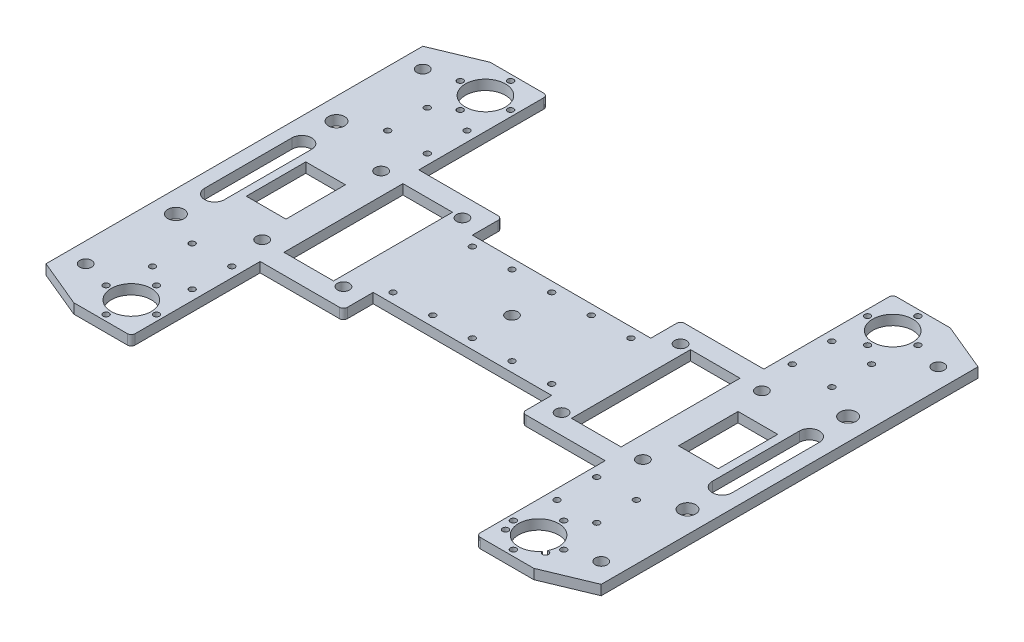
from build123d import *

# Parameters (mm, degrees)
ESQUISSE2_R                   = 3
ESQUISSE2_R_2                 = 10.1
ESQUISSE2_R_3                 = 1.5
ESQUISSE2_R_4                 = 4.1
ESQUISSE2_W                   = 25
ESQUISSE2_H                   = 60
ESQUISSE2_W_2                 = 20
ESQUISSE2_H_2                 = 30
BOSS_EXTRU_1_DEPTH            = 5
CONG_2_R                      = 2
DIAM_TRE_DU_PER_AGE_3_0_3_1_D = 3
ESQUISSE6_R                   = 1.495854397
ESQUISSE6_R_2                 = 1.51008819
ENL_V_MAT_EXTRU_1_DEPTH       = 10


with BuildPart() as part:
    # Esquisse2 → Boss.-Extru.1 (new body)
    with BuildSketch(Plane(origin=(0, 0, 0), x_dir=(1, 0, 0), z_dir=(0, 1, 0))):
        Polygon((-140, 95), (-140, -95), (-116, -105), (-87, -105), (-87, -40), (-45, -40), (-45, -25), (45, -25), (45, -40), (87, -40), (87, -105), (116, -105), (140, -95), (140, 95), (116, 105), (87, 105), (87, 40), (45, 40), (45, 25), (-45, 25), (-45, 40), (-87, 40), (-87, 105), (-116, 105), align=None)
        with Locations(Location((-96, 30, 0), (0, 0, 270))):
            Circle(ESQUISSE2_R, mode=Mode.SUBTRACT)
        with Locations(Location((-96, -30, 0), (0, 0, 270))):
            Circle(ESQUISSE2_R, mode=Mode.SUBTRACT)
        with Locations(Location((-55, -30, 0), (0, 0, 270))):
            Circle(ESQUISSE2_R, mode=Mode.SUBTRACT)
        with Locations(Location((-55, 30, 0), (0, 0, 270))):
            Circle(ESQUISSE2_R, mode=Mode.SUBTRACT)
        with Locations(Location((-130, 85, 0), (0, 0, 270))):
            Circle(ESQUISSE2_R, mode=Mode.SUBTRACT)
        with Locations(Location((-130, -85, 0), (0, 0, 270))):
            Circle(ESQUISSE2_R, mode=Mode.SUBTRACT)
        with Locations(Location((-102.7, 89.3, 0), (0, 0, 270))):
            Circle(ESQUISSE2_R_2, mode=Mode.SUBTRACT)
        with Locations(Location((-90, 89.3, 0), (0, 0, 270))):
            Circle(ESQUISSE2_R_3, mode=Mode.SUBTRACT)
        with Locations(Location((-102.7, 102, 0), (0, 0, 270))):
            Circle(ESQUISSE2_R_3, mode=Mode.SUBTRACT)
        with Locations(Location((-115.4, 89.3, 0), (0, 0, 270))):
            Circle(ESQUISSE2_R_3, mode=Mode.SUBTRACT)
        with Locations(Location((-102.7, 76.6, 0), (0, 0, 270))):
            Circle(ESQUISSE2_R_3, mode=Mode.SUBTRACT)
        with Locations(Location((-102.7, -89.3, 0), (0, 0, 270))):
            Circle(ESQUISSE2_R_2, mode=Mode.SUBTRACT)
        with Locations(Location((-90, -89.3, 0), (0, 0, 270))):
            Circle(ESQUISSE2_R_3, mode=Mode.SUBTRACT)
        with Locations(Location((-102.7, -76.6, 0), (0, 0, 270))):
            Circle(ESQUISSE2_R_3, mode=Mode.SUBTRACT)
        with Locations(Location((-115.4, -89.3, 0), (0, 0, 270))):
            Circle(ESQUISSE2_R_3, mode=Mode.SUBTRACT)
        with Locations(Location((-102.7, -102, 0), (0, 0, 270))):
            Circle(ESQUISSE2_R_3, mode=Mode.SUBTRACT)
        with Locations(Location((102.7, -102, 0), (0, 0, 90))):
            Circle(ESQUISSE2_R_3, mode=Mode.SUBTRACT)
        with Locations(Location((115.4, -89.3, 0), (0, 0, 90))):
            Circle(ESQUISSE2_R_3, mode=Mode.SUBTRACT)
        with Locations(Location((102.7, -76.6, 0), (0, 0, 90))):
            Circle(ESQUISSE2_R_3, mode=Mode.SUBTRACT)
        with Locations(Location((90, -89.3, 0), (0, 0, 90))):
            Circle(ESQUISSE2_R_3, mode=Mode.SUBTRACT)
        with Locations(Location((102.7, -89.3, 0), (0, 0, 90))):
            Circle(ESQUISSE2_R_2, mode=Mode.SUBTRACT)
        with Locations(Location((102.7, 76.6, 0), (0, 0, 90))):
            Circle(ESQUISSE2_R_3, mode=Mode.SUBTRACT)
        with Locations(Location((115.4, 89.3, 0), (0, 0, 90))):
            Circle(ESQUISSE2_R_3, mode=Mode.SUBTRACT)
        with Locations(Location((102.7, 102, 0), (0, 0, 90))):
            Circle(ESQUISSE2_R_3, mode=Mode.SUBTRACT)
        with Locations(Location((90, 89.3, 0), (0, 0, 90))):
            Circle(ESQUISSE2_R_3, mode=Mode.SUBTRACT)
        with Locations(Location((102.7, 89.3, 0), (0, 0, 90))):
            Circle(ESQUISSE2_R_2, mode=Mode.SUBTRACT)
        with Locations(Location((130, -85, 0), (0, 0, 90))):
            Circle(ESQUISSE2_R, mode=Mode.SUBTRACT)
        with Locations(Location((130, 85, 0), (0, 0, 90))):
            Circle(ESQUISSE2_R, mode=Mode.SUBTRACT)
        with Locations(Location((55, 30, 0), (0, 0, 90))):
            Circle(ESQUISSE2_R, mode=Mode.SUBTRACT)
        with Locations(Location((55, -30, 0), (0, 0, 90))):
            Circle(ESQUISSE2_R, mode=Mode.SUBTRACT)
        with Locations(Location((96, -30, 0), (0, 0, 90))):
            Circle(ESQUISSE2_R, mode=Mode.SUBTRACT)
        with Locations(Location((96, 30, 0), (0, 0, 90))):
            Circle(ESQUISSE2_R, mode=Mode.SUBTRACT)
        with Locations(Location((-129, 40.5, 0), (0, 0, 270))):
            Circle(ESQUISSE2_R_4, mode=Mode.SUBTRACT)
        with Locations(Location((-129, -40.5, 0), (0, 0, 270))):
            Circle(ESQUISSE2_R_4, mode=Mode.SUBTRACT)
        with Locations(Location((129, -40.5, 0), (0, 0, 90))):
            Circle(ESQUISSE2_R_4, mode=Mode.SUBTRACT)
        with Locations(Location((129, 40.5, 0), (0, 0, 90))):
            Circle(ESQUISSE2_R_4, mode=Mode.SUBTRACT)
        with Locations(Location((0, 0, 0), (0, 0, 270))):
            Circle(ESQUISSE2_R, mode=Mode.SUBTRACT)
        with Locations((-72.5, 0)):
            Rectangle(ESQUISSE2_W, ESQUISSE2_H, mode=Mode.SUBTRACT)
        with BuildLine():
            Line((-123, 22), (-123, -22))
            ThreePointArc((-123, -22), (-128, -27), (-133, -22))
            Line((-133, -22), (-133, 22))
            ThreePointArc((-133, 22), (-128, 27), (-123, 22))
        make_face(mode=Mode.SUBTRACT)
        with Locations((-109, 0)):
            Rectangle(ESQUISSE2_W_2, ESQUISSE2_H_2, mode=Mode.SUBTRACT)
        with Locations((109, 0)):
            Rectangle(ESQUISSE2_W_2, ESQUISSE2_H_2, mode=Mode.SUBTRACT)
        with Locations((72.5, 0)):
            Rectangle(ESQUISSE2_W, ESQUISSE2_H, mode=Mode.SUBTRACT)
        with BuildLine():
            Line((123, 22), (123, -22))
            ThreePointArc((123, -22), (128, -27), (133, -22))
            Line((133, -22), (133, 22))
            ThreePointArc((133, 22), (128, 27), (123, 22))
        make_face(mode=Mode.SUBTRACT)
    extrude(amount=BOSS_EXTRU_1_DEPTH)

    # Congé2
    cong_2_edges = [part.edges().sort_by_distance(p)[0] for p in [
        (-87, 2.5, -105),
        (-45, 2.5, -40),
        (45, 2.5, -40),
        (87, 2.5, -105),
        (87, 2.5, 105),
        (45, 2.5, 40),
        (-45, 2.5, 40),
        (-87, 2.5, 105),
    ]]
    fillet(cong_2_edges, radius=CONG_2_R)

    # Diamètre du perçage Ø3.0 (3)1 (through all)
    with Locations(Plane(origin=(0, 5, 0), x_dir=(1, 0, 0), z_dir=(0, 1, 0))):
        with Locations((-92, 69.3), (-92, 49.3), (-20, 20), (0, 20), (20, 20), (20, -20), (0, -20), (-20, -20), (-92, -69.3), (-92, -49.3), (92, -69.3), (92, -49.3), (92, 69.3), (92, 49.3), (112, 69.3), (112, 49.3), (-112, 69.3), (-112, 49.3), (-112, -49.3), (-112, -69.3), (112, -69.3), (112, -49.3), (40, -20), (40, 20), (-40, 20), (-40, -20)):
            Hole(DIAM_TRE_DU_PER_AGE_3_0_3_1_D / 2)

    # Esquisse6 → Enlèv. mat.-Extru.1 (cut)
    with BuildSketch(Plane.XZ):
        with Locations((112.218706977, 95.273590322)):
            Circle(ESQUISSE6_R)
        with Locations(Location((91.995720379, 95.273590322, 0), (0, 0, 270))):
            Circle(ESQUISSE6_R_2)
    extrude(amount=-ENL_V_MAT_EXTRU_1_DEPTH, mode=Mode.SUBTRACT)


solid = part.part
